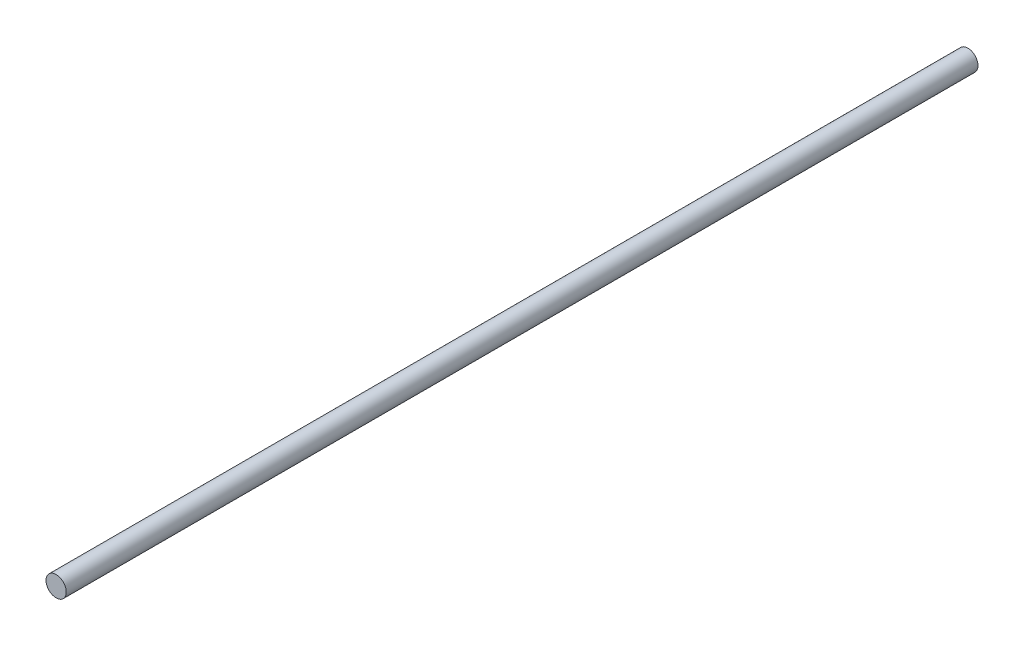
from build123d import *

# Parameters (mm, degrees)
SKETCH1_R           = 1
BOSS_EXTRUDE1_DEPTH = 90


with BuildPart() as part:
    # Sketch1 → Boss-Extrude1 (new body)
    with BuildSketch(Plane.XY):
        with Locations(Location((0, 0, 0), (0, 0, 180))):
            Circle(SKETCH1_R)
    extrude(amount=BOSS_EXTRUDE1_DEPTH)


solid = part.part
